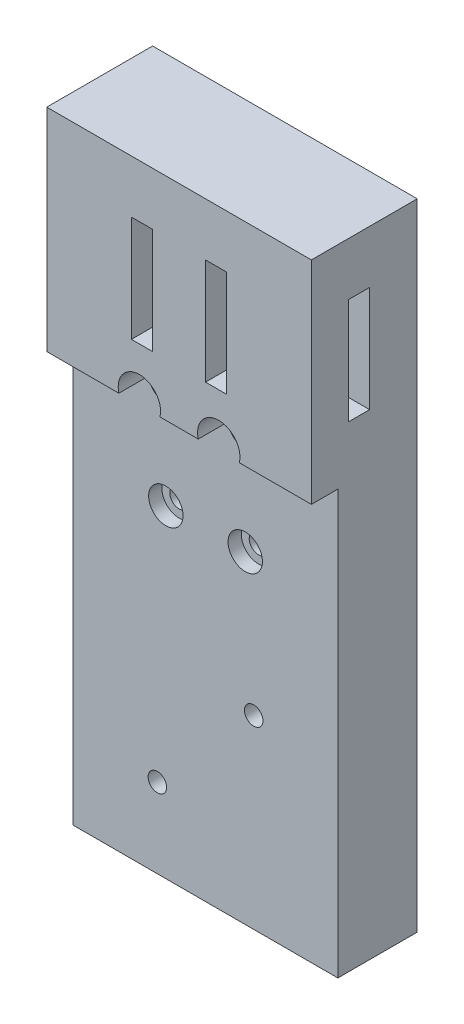
from build123d import *

# Parameters (mm, degrees)
SKETCH1_W           = 50
SKETCH1_H           = 100
BOSS_EXTRUDE1_DEPTH = 20
SKETCH2_W           = 4
SKETCH2_H           = 20
CUT_EXTRUDE1_DEPTH  = 20
SKETCH3_W           = 4
SKETCH3_H           = 20
CUT_EXTRUDE2_DEPTH  = 16
SKETCH4_W           = 5
SKETCH4_H           = 60
CUT_EXTRUDE3_DEPTH  = 114.578166916
SKETCH6_R           = 1.75
CUT_EXTRUDE5_DEPTH  = 114.578166916
SKETCH7_R           = 4
CUT_EXTRUDE6_DEPTH  = 5
SKETCH8_R           = 3.25
CUT_EXTRUDE7_DEPTH  = 2.5
SKETCH9_W           = 50
SKETCH9_H           = 20
BOSS_EXTRUDE2_DEPTH = 15
SKETCH5_R           = 1.75
CUT_EXTRUDE4_DEPTH  = 113.805141727


with BuildPart() as part:
    # Sketch1 → Boss-Extrude1 (new body)
    with BuildSketch(Plane.XY):
        with Locations((25, 50)):
            Rectangle(SKETCH1_W, SKETCH1_H)
    extrude(amount=BOSS_EXTRUDE1_DEPTH)

    # Sketch2 → Cut-Extrude1 (cut)
    with BuildSketch(Plane.ZY):
        with Locations((11, 80)):
            Rectangle(SKETCH2_W, SKETCH2_H)
    cut_extrude1 = extrude(amount=-CUT_EXTRUDE1_DEPTH, mode=Mode.SUBTRACT)

    # Sketch3 → Cut-Extrude2 (cut)
    with BuildSketch(Plane.XY.offset(20)):
        with Locations((18, 80)):
            Rectangle(SKETCH3_W, SKETCH3_H)
    cut_extrude2 = extrude(amount=-CUT_EXTRUDE2_DEPTH, mode=Mode.SUBTRACT)

    # Mirror1: Cut-Extrude1, Cut-Extrude2 across plane
    add(cut_extrude1.mirror(Plane.ZY.offset(-25)), mode=Mode.SUBTRACT)
    add(cut_extrude2.mirror(Plane.ZY.offset(-25)), mode=Mode.SUBTRACT)

    # Sketch4 → Cut-Extrude3 (cut, through all)
    with BuildSketch(Plane.ZY):
        with Locations((17.5, 30)):
            Rectangle(SKETCH4_W, SKETCH4_H)
    extrude(amount=-CUT_EXTRUDE3_DEPTH, mode=Mode.SUBTRACT)

    # Sketch6 → Cut-Extrude5 (cut, through all)
    with BuildSketch(Plane.XY.offset(20)):
        with BuildLine():
            ThreePointArc((19.25, 61), (16.975951413, 62.66969251), (16.063859338, 60))
            Line((16.063859338, 60), (18.936140662, 60))
            ThreePointArc((18.936140662, 60), (19.16969251, 60.475951413), (19.25, 61))
        make_face()
        with BuildLine():
            Line((18.936140662, 60), (16.063859338, 60))
            ThreePointArc((16.063859338, 60), (17.5, 59.25), (18.936140662, 60))
        make_face()
        with BuildLine():
            ThreePointArc((34.25, 61), (31.975951413, 62.66969251), (31.063859338, 60))
            Line((31.063859338, 60), (33.936140662, 60))
            ThreePointArc((33.936140662, 60), (34.16969251, 60.475951413), (34.25, 61))
        make_face()
        with BuildLine():
            Line((33.936140662, 60), (31.063859338, 60))
            ThreePointArc((31.063859338, 60), (32.5, 59.25), (33.936140662, 60))
        make_face()
        with Locations((32.5, 41)):
            Circle(SKETCH6_R)
        with Locations((17.5, 41)):
            Circle(SKETCH6_R)
    extrude(amount=-CUT_EXTRUDE5_DEPTH, mode=Mode.SUBTRACT)

    # Sketch7 → Cut-Extrude6 (cut)
    with BuildSketch(Plane.XY.offset(20)):
        with Locations((32.5, 61)):
            Circle(SKETCH7_R)
        with Locations((17.5, 61)):
            Circle(SKETCH7_R)
    extrude(amount=-CUT_EXTRUDE6_DEPTH, mode=Mode.SUBTRACT)

    # Sketch8 → Cut-Extrude7 (cut)
    with BuildSketch(Plane.XY.offset(15)):
        with Locations((17.5, 61)):
            Circle(SKETCH8_R)
        with Locations((32.5, 61)):
            Circle(SKETCH8_R)
        with Locations((32.5, 41)):
            Circle(SKETCH8_R)
        with Locations((17.5, 41)):
            Circle(SKETCH8_R)
    extrude(amount=-CUT_EXTRUDE7_DEPTH, mode=Mode.SUBTRACT)

    # Sketch9 → Boss-Extrude2 (add)
    with BuildSketch(Plane.XY.offset(15)):
        with Locations((25, -10)):
            Rectangle(SKETCH9_W, SKETCH9_H)
    extrude(amount=-BOSS_EXTRUDE2_DEPTH)

    # Sketch5 → Cut-Extrude4 (cut, through all)
    with BuildSketch(Plane.XY.offset(15)):
        with Locations((34.1, 15)):
            Circle(SKETCH5_R)
        with Locations((15.9, -5)):
            Circle(SKETCH5_R)
    extrude(amount=-CUT_EXTRUDE4_DEPTH, mode=Mode.SUBTRACT)


solid = part.part
